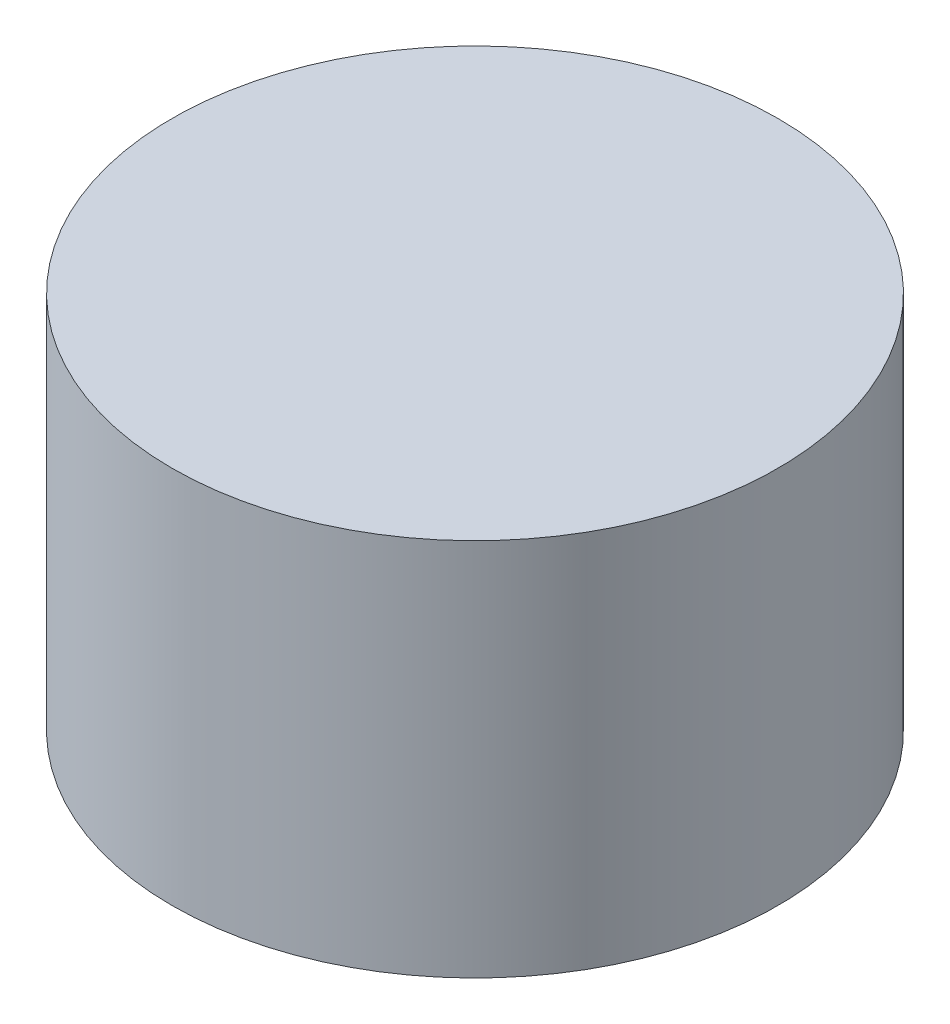
from build123d import *

# Parameters (mm, degrees)
SKETCH1_R           = 20.32
BOSS_EXTRUDE1_DEPTH = 25.4
SKETCH2_R           = 16.51
CUT_EXTRUDE1_DEPTH  = 15.24


with BuildPart() as part:
    # Sketch1 → Boss-Extrude1 (new body)
    with BuildSketch(Plane(origin=(0, 0, 0), x_dir=(1, 0, 0), z_dir=(0, 1, 0))):
        with Locations(Location((0, 0, 0), (0, 0, 270))):
            Circle(SKETCH1_R)
    extrude(amount=BOSS_EXTRUDE1_DEPTH)

    # Sketch2 → Cut-Extrude1 (cut)
    with BuildSketch(Plane.XZ):
        with Locations(Location((0, 0, 0), (0, 0, 270))):
            Circle(SKETCH2_R)
    extrude(amount=-CUT_EXTRUDE1_DEPTH, mode=Mode.SUBTRACT)


solid = part.part
